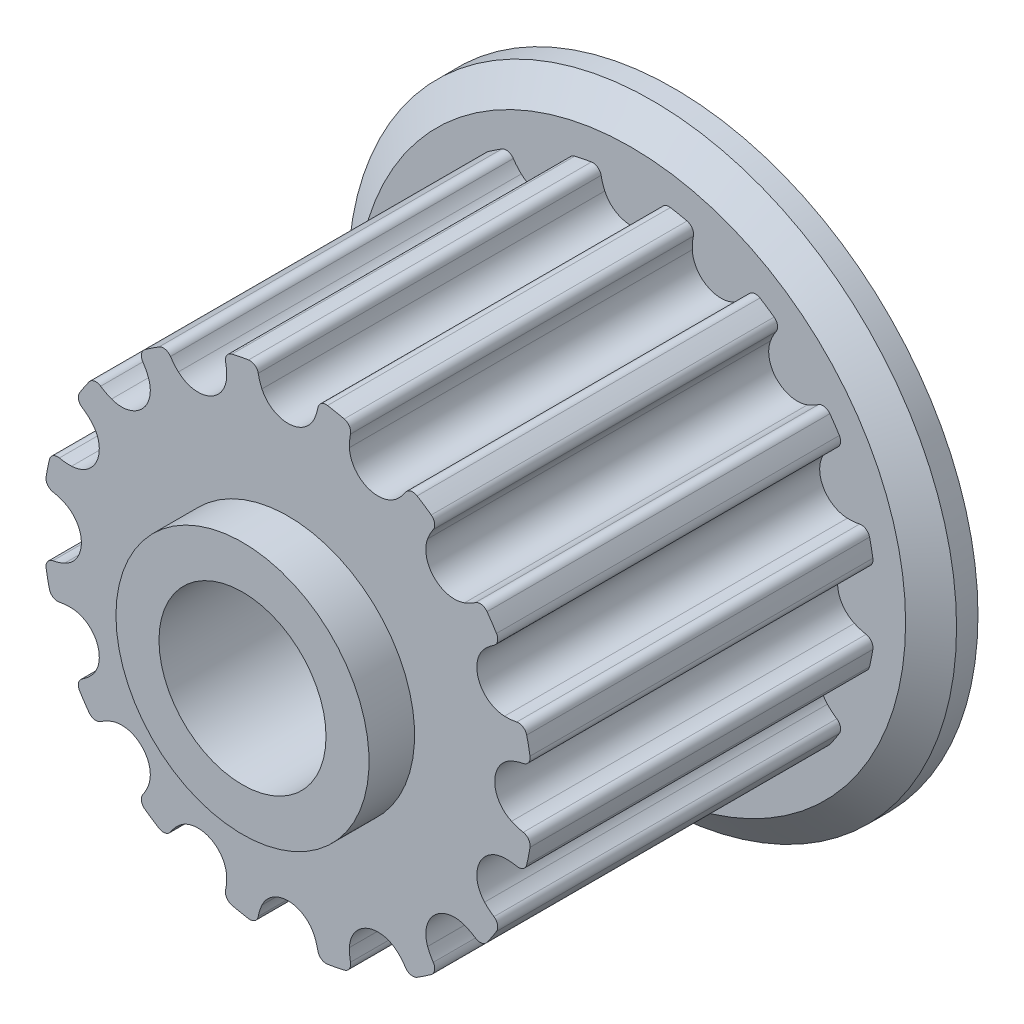
from build123d import *

# Parameters (mm, degrees)
CUT_EXTRUDE1_START  = 2.655
CUT_EXTRUDE1_DEPTH  = 10.16
CIRPATTERN1_COUNT   = 16
SKETCH4_R           = 1.7526
CUT_EXTRUDE2_DEPTH  = 16.477114557
CUT_EXTRUDE3_DEPTH  = 1.31445
CIRPATTERN3_COUNT   = 2
CIRPATTERN3_ANGLE   = 90
CHAMFER1_SIZE       = 0.28075
CUT_EXTRUDE4_START  = -6.12
SKETCH7_R           = 9.015
CUT_EXTRUDE4_DEPTH  = 6.12
SKETCH8_R           = 2.475
CUT_EXTRUDE5_DEPTH  = 18.122656044
SKETCH9_R           = 3.75
SKETCH9_R_2         = 2.475
BOSS_EXTRUDE1_DEPTH = 1.35


with BuildPart() as part:
    # Sketch2 → Revolve1 (revolve)
    with BuildSketch(Plane(origin=(0, 0, 0), x_dir=(0, 0, -1), z_dir=(1, 0, 0)), mode=Mode.PRIVATE) as revolve1_sk:
        Polygon((-8.775, 2.38125), (8.775, 2.38125), (8.775, 9.015), (8.14, 9.015), (7.505, 8.13975), (7.505, 7.2645), (-2.655, 7.2645), (-2.655, 8.13975), (-3.29, 9.015), (-8.775, 9.015), align=None)
    revolve(revolve1_sk.sketch.rotate(Axis((0, 0, 8.775), (0, 0, -1)), 90), axis=Axis((0, 0, 8.775), (0, 0, -1)))

    # Sketch3 → Cut-Extrude1 (cut)
    with BuildSketch(Plane.XY.offset(CUT_EXTRUDE1_START)):
        with BuildLine():
            Line((3.757926927, 9.015), (-3.757926927, 9.015))
            Line((-3.757926927, 9.015), (-2.795101196, 6.705249403))
            ThreePointArc((-2.795101196, 6.705249403), (-1.995846132, 6.984952288), (-1.169472895, 7.169748489))
            ThreePointArc((-1.169472895, 7.169748489), (-0.985767742, 7.127751824), (-0.883573242, 6.969424355))
            ThreePointArc((-0.883573242, 6.969424355), (-0.839120956, 6.792881518), (-0.773880597, 6.622919538))
            ThreePointArc((-0.773880597, 6.622919538), (0, 6.1245), (0.773880597, 6.622919538))
            ThreePointArc((0.773880597, 6.622919538), (0.839120956, 6.792881518), (0.883573242, 6.969424355))
            ThreePointArc((0.883573242, 6.969424355), (0.985767742, 7.127751824), (1.169472895, 7.169748489))
            ThreePointArc((1.169472895, 7.169748489), (1.995846132, 6.984952288), (2.795101196, 6.705249403))
            Line((2.795101196, 6.705249403), (3.757926927, 9.015))
        make_face()
    cut_extrude1 = extrude(amount=-CUT_EXTRUDE1_DEPTH, mode=Mode.SUBTRACT)

    # CirPattern1: Cut-Extrude1 ×16 about axis
    cirpattern1_axis = Axis((0, 0, 0), (0, 0, 1))
    for i in range(1, CIRPATTERN1_COUNT):
        add(cut_extrude1.rotate(cirpattern1_axis, i * 360 / CIRPATTERN1_COUNT), mode=Mode.SUBTRACT)

    # Sketch4 → Cut-Extrude2 (cut, through all)
    with BuildSketch(Plane(origin=(0, 0, 0), x_dir=(0, -1, 0), z_dir=(1, 0, 0))):
        with Locations(Location((0, -5.715, 0), (0, 0, 270))):
            Circle(SKETCH4_R)
    cut_extrude2 = extrude(amount=CUT_EXTRUDE2_DEPTH, mode=Mode.SUBTRACT)

    # Sketch5 → Revolve2 (revolve)
    with BuildSketch(Plane.XY.offset(5.715), mode=Mode.PRIVATE) as revolve2_sk:
        Polygon((2.38125, -1.3716), (2.38125, 0), (8.842998261, 0), (8.842998261, -1.3716), (8.461998261, -1.7526), (2.76225, -1.7526), align=None)
    revolve2 = revolve(revolve2_sk.sketch.rotate(Axis((2.38125, 0, 5.715), (1, 0, 0)), 270), axis=Axis((2.38125, 0, 5.715), (1, 0, 0)))

    # Sketch6 → Cut-Extrude3 (cut)
    with BuildSketch(Plane(origin=(8.842998261, 5.384140679, 0), x_dir=(0, -1, 0), z_dir=(-1, 0, 0))):
        Polygon((5.384140679, 6.726864082), (4.507840679, 6.220932041), (4.507840679, 5.209067959), (5.384140679, 4.703135918), (6.260440679, 5.209067959), (6.260440679, 6.220932041), align=None)
    cut_extrude3 = extrude(amount=CUT_EXTRUDE3_DEPTH, mode=Mode.SUBTRACT)

    # CirPattern3: Cut-Extrude2, Revolve2, Cut-Extrude3 ×2 about axis
    cirpattern3_axis = Axis((0, 0, 0), (0, 0, 1))
    add([cut_extrude2.rotate(cirpattern3_axis, i * CIRPATTERN3_ANGLE / (CIRPATTERN3_COUNT - 1)) for i in range(1, CIRPATTERN3_COUNT)], mode=Mode.SUBTRACT)
    add([revolve2.rotate(cirpattern3_axis, i * CIRPATTERN3_ANGLE / (CIRPATTERN3_COUNT - 1)) for i in range(1, CIRPATTERN3_COUNT)])
    add([cut_extrude3.rotate(cirpattern3_axis, i * CIRPATTERN3_ANGLE / (CIRPATTERN3_COUNT - 1)) for i in range(1, CIRPATTERN3_COUNT)], mode=Mode.SUBTRACT)

    # Chamfer1
    chamfer1_edges = [part.edges().sort_by_distance(p)[0] for p in [
        (-2.38125, 0, 8.775),
        (-9.015, 0, 8.775),
    ]]
    chamfer(chamfer1_edges, length=CHAMFER1_SIZE)

    # Sketch7 → Cut-Extrude4 (cut)
    with BuildSketch(Plane.XY.offset(8.775).offset(CUT_EXTRUDE4_START)):
        Circle(SKETCH7_R)
    extrude(amount=CUT_EXTRUDE4_DEPTH, mode=Mode.SUBTRACT)

    # Sketch8 → Cut-Extrude5 (cut, through all)
    with BuildSketch(Plane(origin=(0, 0, -8.775), x_dir=(-1, 0, 0), z_dir=(0, 0, -1))):
        Circle(SKETCH8_R)
    extrude(amount=-CUT_EXTRUDE5_DEPTH, mode=Mode.SUBTRACT)

    # Sketch9 → Boss-Extrude1 (add)
    with BuildSketch(Plane.XY.offset(2.655)):
        with Locations(Location((0, 0, 0), (0, 0, 180))):
            Circle(SKETCH9_R)
        with Locations(Location((0, 0, 0), (0, 0, 180))):
            Circle(SKETCH9_R_2, mode=Mode.SUBTRACT)
    extrude(amount=BOSS_EXTRUDE1_DEPTH)


solid = part.part
